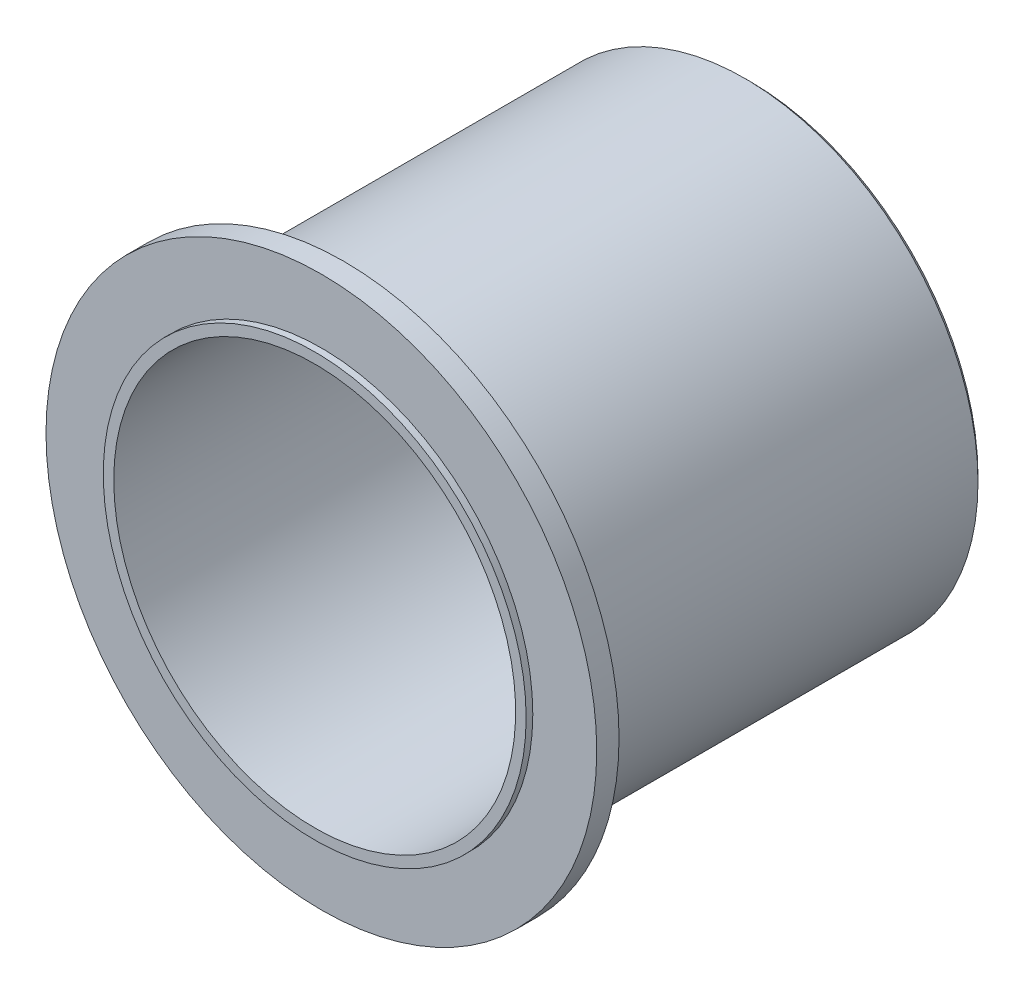
from build123d import *

# Parameters (mm, degrees)
SKETCH2_R          = 30.175
CUT_EXTRUDE1_DEPTH = 88.694170274
CHAMFER1_SIZE      = 0.75
CHAMFER2_SIZE      = 3
CHAMFER2_SIZE2     = 5.196152423
FILLET1_R          = 3


with BuildPart() as part:
    # Sketch1 → Revolve1 (revolve)
    with BuildSketch(Plane(origin=(0, 0, 0), x_dir=(1, 0, 0), z_dir=(0, 1, 0)), mode=Mode.PRIVATE) as revolve1_sk:
        Polygon((0, 0), (0, 65.35), (-35, 65.35), (-35, 7.35), (-41.35, 7.35), (-41.35, 1), (-31.75, 1), (-31.75, 0), align=None)
    revolve(revolve1_sk.sketch.rotate(Axis((0, 0, 0), (0, 0, -1)), 180), axis=Axis((0, 0, 0), (0, 0, -1)))

    # Sketch2 → Cut-Extrude1 (cut, through all)
    with BuildSketch(Plane(origin=(0, 0, -65.35), x_dir=(-1, 0, 0), z_dir=(0, 0, -1))):
        Circle(SKETCH2_R)
    extrude(amount=-CUT_EXTRUDE1_DEPTH, mode=Mode.SUBTRACT)

    # Chamfer1
    chamfer1_edges = [part.edges().sort_by_distance(p)[0] for p in [
        (-35, 0, -7.35),
        (-35, 0, -65.35),
    ]]
    chamfer(chamfer1_edges, length=CHAMFER1_SIZE)

    # Chamfer2
    chamfer2_edges = [part.edges().sort_by_distance(p)[0] for p in [
        (-41.35, 0, -7.35),
    ]]
    chamfer2_side = [part.faces().sort_by_distance(p)[0] for p in [
        (-41.35, 0, -4.175),
    ]]
    chamfer(chamfer2_edges, length=CHAMFER2_SIZE, length2=CHAMFER2_SIZE2, reference=chamfer2_side[0])

    # Fillet1
    fillet1_edges = [part.edges().sort_by_distance(p)[0] for p in [
        (30.175, 0, -65.35),
    ]]
    fillet(fillet1_edges, radius=FILLET1_R)


solid = part.part
